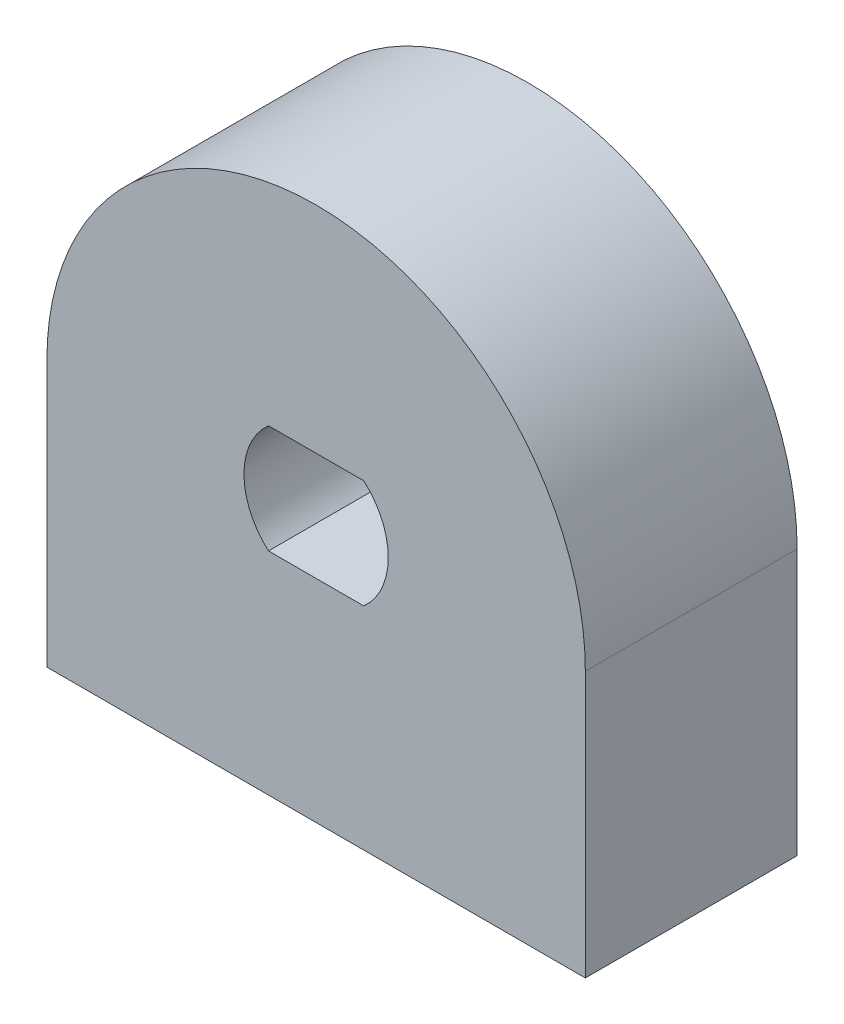
from build123d import *

# Parameters (mm, degrees)
EXTRUSION1_DEPTH = 5.9


with BuildPart() as part:
    # Esquisse1 → Extrusion1 (new body)
    with BuildSketch(Plane.XY):
        with BuildLine():
            Line((0, 0), (15, 0))
            Line((15, 0), (15, 7.4))
            ThreePointArc((15, 7.4), (7.5, 14.9), (0, 7.4))
            Line((0, 7.4), (0, 0))
        make_face()
        with BuildLine():
            Line((6.173350084, 8.91), (8.826649916, 8.91))
            ThreePointArc((8.826649916, 8.91), (9.51, 7.4), (8.826649916, 5.89))
            Line((8.826649916, 5.89), (6.173350084, 5.89))
            ThreePointArc((6.173350084, 5.89), (5.49, 7.4), (6.173350084, 8.91))
        make_face(mode=Mode.SUBTRACT)
    extrude(amount=EXTRUSION1_DEPTH)


solid = part.part
